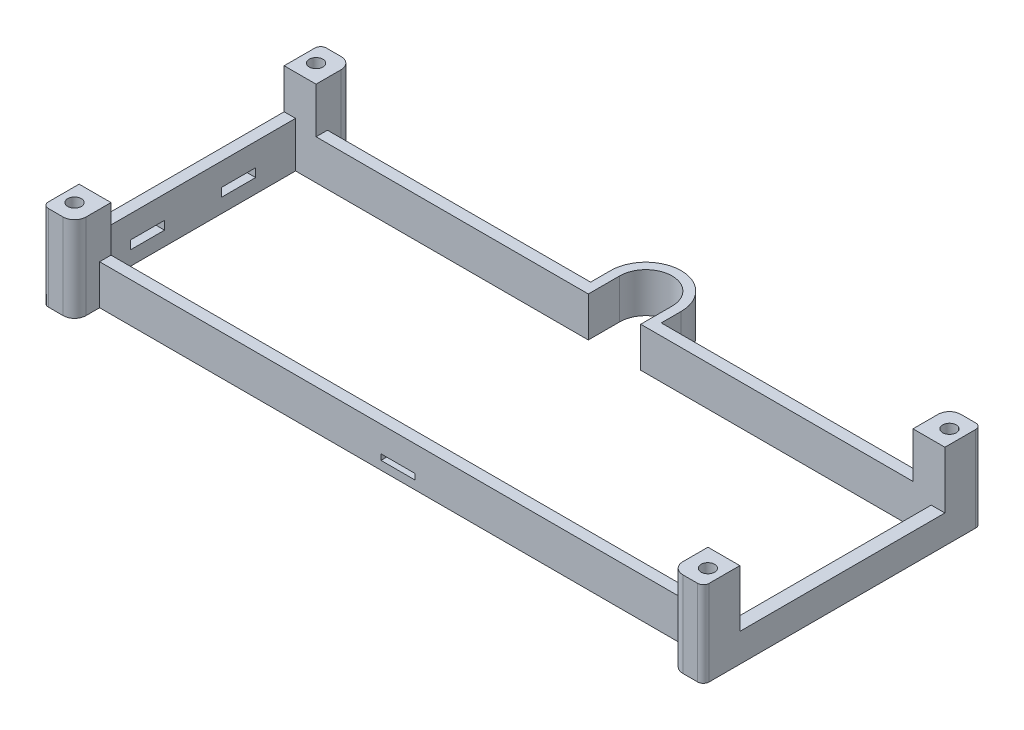
from build123d import *

# Parameters (mm, degrees)
SKETCH1_R               = 1.2
BOSS_EXTRUDE1_DEPTH     = 15
SKETCH3_W               = 15
SKETCH3_H               = 36
BOSS_EXTRUDE3_DEPTH     = 1.5
BOSS_EXTRUDE4_DEPTH     = 36
SKETCH6_R               = 1.2
BOSS_EXTRUDE5_DEPTH     = 15
SKETCH7_W               = 2
SKETCH7_H               = 36
BOSS_EXTRUDE6_DEPTH     = 8
SKETCH8_W               = 6
SKETCH8_H               = 1
CUT_EXTRUDE1_DEPTH      = 5
SKETCH9_W               = 6
SKETCH9_H               = 1.5
CUT_EXTRUDE2_DEPTH      = 5
CUT_EXTRUDE3_DEPTH      = 123.887428161
CUT_EXTRUDE3_DEPTH_BACK = 123.887428161
SKETCH10_W              = 104.8
SKETCH10_H              = 8
SKETCH11_W              = 36
SKETCH11_H              = 10
CUT_EXTRUDE4_DEPTH      = 10
SKETCH12_W              = 15
SKETCH12_H              = 36
CUT_EXTRUDE5_DEPTH      = 10


with BuildPart() as part:
    # Sketch1 → Boss-Extrude1 (new body)
    with BuildSketch(Plane(origin=(0, 0, 0), x_dir=(1, 0, 0), z_dir=(0, 1, 0))):
        with BuildLine():
            Line((2.4, -23.4), (2.4, 23.4))
            ThreePointArc((2.4, 23.4), (2.107106781, 24.107106781), (1.4, 24.4))
            Line((1.4, 24.4), (-1.2, 24.4))
            ThreePointArc((-1.2, 24.4), (-2.614213562, 23.814213562), (-3.2, 22.4))
            Line((-3.2, 22.4), (-3.2, 20))
            Line((-3.2, 20), (-15, 20))
            Line((-15, 20), (-15, 18))
            Line((-15, 18), (0, 18))
            Line((0, 18), (0, -18))
            Line((0, -18), (-15, -18))
            Line((-15, -18), (-15, -20))
            Line((-15, -20), (-3.2, -20))
            Line((-3.2, -20), (-3.2, -22.4))
            ThreePointArc((-3.2, -22.4), (-2.614213562, -23.814213562), (-1.2, -24.4))
            Line((-1.2, -24.4), (1.4, -24.4))
            ThreePointArc((1.4, -24.4), (2.107106781, -24.107106781), (2.4, -23.4))
        make_face()
        with Locations(Location((0, -21.2, 0), (0, 0, 270))):
            Circle(SKETCH1_R, mode=Mode.SUBTRACT)
        with Locations(Location((0, 21.2, 0), (0, 0, 90))):
            Circle(SKETCH1_R, mode=Mode.SUBTRACT)
    extrude(amount=BOSS_EXTRUDE1_DEPTH)

    # Sketch3 → Boss-Extrude3 (add)
    with BuildSketch(Plane(origin=(0, 0, 0), x_dir=(1, 0, 0), z_dir=(0, 1, 0))):
        with Locations((-7.5, 0)):
            Rectangle(SKETCH3_W, SKETCH3_H)
    extrude(amount=BOSS_EXTRUDE3_DEPTH)

    # Sketch4 → Boss-Extrude4 (add)
    with BuildSketch(Plane.ZY.offset(15)):
        Polygon((-18, 1.5), (-18, 0), (-20, 0), (-20, 15), (-18, 15), align=None)
    extrude(amount=BOSS_EXTRUDE4_DEPTH)

    # Sketch6 → Boss-Extrude5 (add)
    # profile 1 of 2: a face of its own
    with BuildSketch(Plane(origin=(0, 15, 0), x_dir=(1, 0, 0), z_dir=(0, 1, 0))):
        with BuildLine():
            Line((-61.8, 20), (-61.8, 23.5))
            ThreePointArc((-61.8, 23.5), (-55.6, 29.7), (-49.4, 23.5))
            Line((-49.4, 23.5), (-49.4, 20))
            Line((-49.4, 20), (-51, 20))
            Line((-51, 20), (-51, 23.5))
            ThreePointArc((-51, 23.5), (-55.6, 28.1), (-60.2, 23.5))
            Line((-60.2, 23.5), (-60.2, 20))
            Line((-60.2, 20), (-60.2, 18))
            Line((-60.2, 18), (-113.6, 18))
            Line((-113.6, 18), (-113.6, 23.4))
            ThreePointArc((-113.6, 23.4), (-113.307106781, 24.107106781), (-112.6, 24.4))
            Line((-112.6, 24.4), (-110, 24.4))
            ThreePointArc((-110, 24.4), (-108.585786438, 23.814213562), (-108, 22.4))
            Line((-108, 22.4), (-108, 20))
            Line((-108, 20), (-61.8, 20))
        make_face()
        with Locations(Location((-111.2, 21.2, 0), (0, 0, 270))):
            Circle(SKETCH6_R, mode=Mode.SUBTRACT)
    # profile 2 of 2: a face of its own
    with BuildSketch(Plane(origin=(0, 15, 0), x_dir=(1, 0, 0), z_dir=(0, 1, 0))):
        with BuildLine():
            Line((-113.6, -18), (-15, -18))
            Line((-15, -18), (-15, -20))
            Line((-15, -20), (-108, -20))
            Line((-108, -20), (-108, -22.4))
            ThreePointArc((-108, -22.4), (-108.585786438, -23.814213562), (-110, -24.4))
            Line((-110, -24.4), (-112.6, -24.4))
            ThreePointArc((-112.6, -24.4), (-113.307106781, -24.107106781), (-113.6, -23.4))
            Line((-113.6, -23.4), (-113.6, -18))
        make_face()
        with Locations(Location((-111.2, -21.2, 0), (0, 0, 90))):
            Circle(SKETCH6_R, mode=Mode.SUBTRACT)
    extrude(amount=-BOSS_EXTRUDE5_DEPTH)

    # Sketch7 → Boss-Extrude6 (add)
    with BuildSketch(Plane.XZ):
        with Locations((-112.6, 0)):
            Rectangle(SKETCH7_W, SKETCH7_H)
    extrude(amount=-BOSS_EXTRUDE6_DEPTH)

    # Sketch8 → Cut-Extrude1 (cut)
    with BuildSketch(Plane(origin=(0, 0, 18), x_dir=(-1, 0, 0), z_dir=(0, 0, -1))):
        with Locations((55.6, 2)):
            Rectangle(SKETCH8_W, SKETCH8_H)
    extrude(amount=-CUT_EXTRUDE1_DEPTH, mode=Mode.SUBTRACT)

    # Sketch9 → Cut-Extrude2 (cut)
    with BuildSketch(Plane(origin=(-111.6, 0, 0), x_dir=(0, 0, -1), z_dir=(1, 0, 0))):
        with Locations((8, 3.25)):
            Rectangle(SKETCH9_W, SKETCH9_H)
        with Locations((-8, 3.25)):
            Rectangle(SKETCH9_W, SKETCH9_H)
    extrude(amount=-CUT_EXTRUDE2_DEPTH, mode=Mode.SUBTRACT)

    # Sketch10 → Cut-Extrude3 (cut, two sides: drawn at the far end of the back side and taken through both)
    with BuildSketch(Plane(origin=(0, 0, -20), x_dir=(-1, 0, 0), z_dir=(0, 0, -1)).offset(-CUT_EXTRUDE3_DEPTH_BACK)):
        with Locations((55.6, 11)):
            Rectangle(SKETCH10_W, SKETCH10_H)
    extrude(amount=CUT_EXTRUDE3_DEPTH + CUT_EXTRUDE3_DEPTH_BACK, mode=Mode.SUBTRACT)

    # Sketch11 → Cut-Extrude4 (cut)
    with BuildSketch(Plane(origin=(2.4, 0, 0), x_dir=(0, 0, -1), z_dir=(1, 0, 0))):
        with Locations((0, 10)):
            Rectangle(SKETCH11_W, SKETCH11_H)
    extrude(amount=-CUT_EXTRUDE4_DEPTH, mode=Mode.SUBTRACT)

    # Sketch12 → Cut-Extrude5 (cut)
    with BuildSketch(Plane.XZ):
        with Locations((-7.5, 0)):
            Rectangle(SKETCH12_W, SKETCH12_H)
    extrude(amount=-CUT_EXTRUDE5_DEPTH, mode=Mode.SUBTRACT)


solid = part.part
